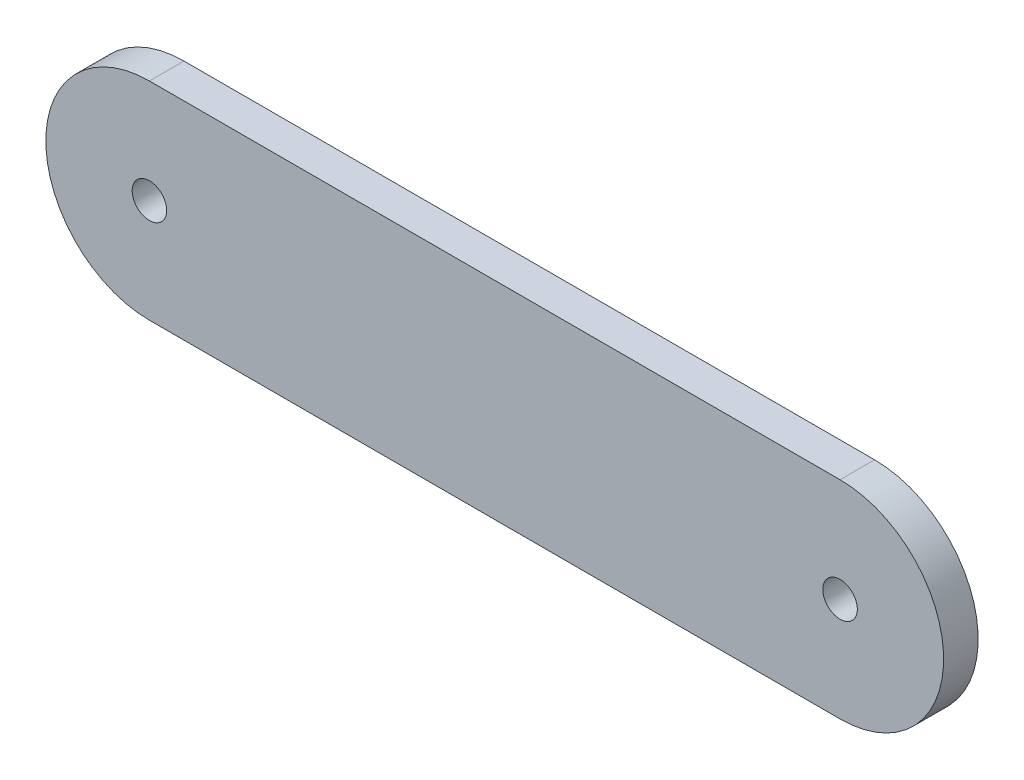
from build123d import *

# Parameters (mm, degrees)
EXTRUDE_1_DEPTH     = 5
SKETCH_2_R          = 2.5
CUT_EXTRUDE_1_DEPTH = 117.081867662


with BuildPart() as part:
    # 草图1 → 凸台-拉伸1 (new body)
    with BuildSketch(Plane.XY):
        with BuildLine():
            Line((0, 15), (100, 15))
            ThreePointArc((100, 15), (115, 0), (100, -15))
            Line((100, -15), (0, -15))
            ThreePointArc((0, -15), (-15, 0), (0, 15))
        make_face()
    extrude(amount=EXTRUDE_1_DEPTH)

    # 草图2 → 切除-拉伸1 (cut, through all)
    with BuildSketch(Plane(origin=(0, 0, 0), x_dir=(-1, 0, 0), z_dir=(0, 0, -1))):
        Circle(SKETCH_2_R)
        with Locations((-100, 0)):
            Circle(SKETCH_2_R)
    extrude(amount=-CUT_EXTRUDE_1_DEPTH, mode=Mode.SUBTRACT)


solid = part.part
